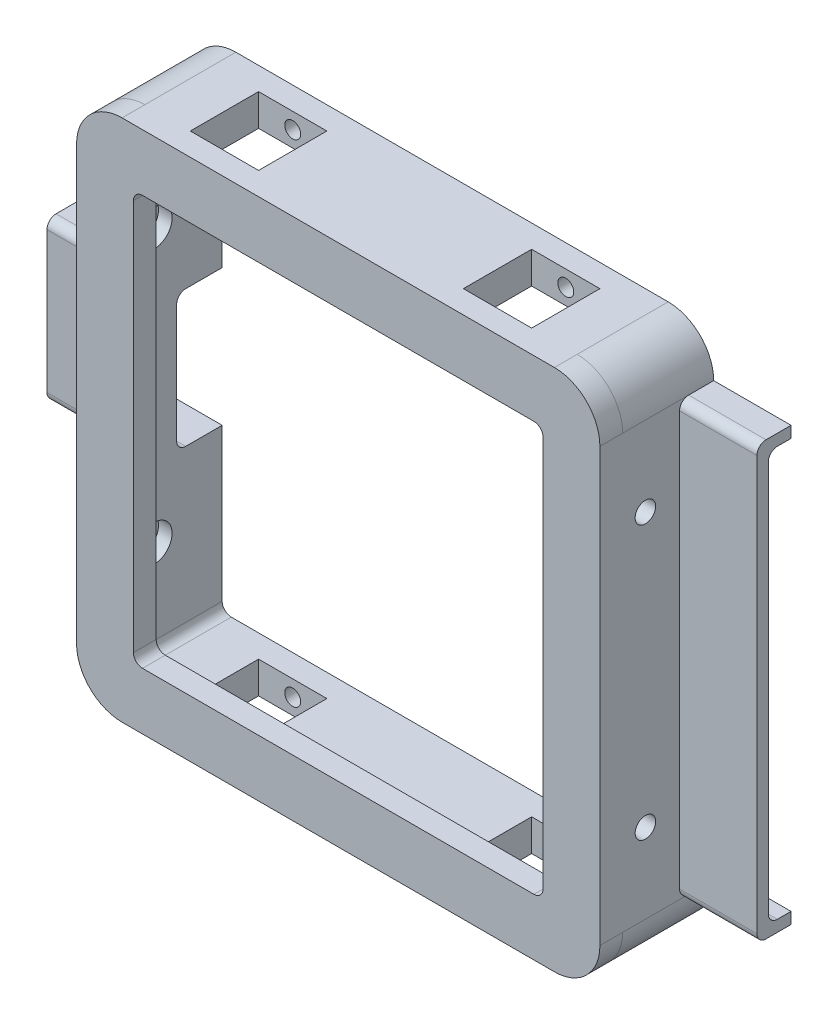
from build123d import *

# Parameters (mm, degrees)
SKETCH1_W                                  = 115
SKETCH1_H                                  = 115
BOSS_EXTRUDE1_DEPTH                        = 20
FILLET1_R                                  = 10
SKETCH2_W                                  = 101
SKETCH2_H                                  = 101
CUT_EXTRUDE1_DEPTH                         = 30
FILLET2_R                                  = 2
SKETCH3_W                                  = 10
SKETCH3_H                                  = 90
CUT_EXTRUDE2_DEPTH                         = 30
SKETCH4_W                                  = 5
SKETCH4_H                                  = 2.5
BOSS_EXTRUDE2_DEPTH                        = 17
FILLET3_R                                  = 2
SKETCH5_W                                  = 20
SKETCH5_H                                  = 30
CUT_EXTRUDE3_DEPTH                         = 22
SKETCH6_W                                  = 10
SKETCH6_H                                  = 2.5
BOSS_EXTRUDE3_DEPTH                        = 19
FILLET4_R                                  = 2
SKETCH7_W                                  = 15
SKETCH7_H                                  = 20
CUT_EXTRUDE4_DEPTH                         = 120
SKETCH9_R                                  = 1.75
CUT_EXTRUDE6_DEPTH                         = 10
MIRROR2_AT_THE_SECOND_PLANE_COPY_1_SKETC_R = 1.75
MIRROR2_AT_THE_SECOND_PLANE_COPY_1_DEPTH   = 10
SKETCH11_R                                 = 2.25
CUT_EXTRUDE7_DEPTH                         = 125
SKETCH12_R                                 = 4
CUT_EXTRUDE8_DEPTH                         = 3
MIRROR4_AT_THE_SECOND_PLANE_COPY_1_SKETC_R = 4
MIRROR4_AT_THE_SECOND_PLANE_COPY_1_DEPTH   = 3
SKETCH14_W                                 = 115
SKETCH14_H                                 = 115
SKETCH14_W_2                               = 90
SKETCH14_H_2                               = 90
BOSS_EXTRUDE4_DEPTH                        = 5
FILLET5_R                                  = 10
FILLET6_R                                  = 2


with BuildPart() as part:
    # Sketch1 → Boss-Extrude1 (new body)
    with BuildSketch(Plane.XY):
        Rectangle(SKETCH1_W, SKETCH1_H)
    extrude(amount=BOSS_EXTRUDE1_DEPTH)

    # Fillet1
    fillet1_edges = [part.edges().sort_by_distance(p)[0] for p in [
        (-57.5, 57.5, 10),
        (57.5, 57.5, 10),
        (57.5, -57.5, 10),
        (-57.5, -57.5, 10),
    ]]
    fillet(fillet1_edges, radius=FILLET1_R)

    # Sketch2 → Cut-Extrude1 (cut)
    with BuildSketch(Plane.XY.offset(20)):
        Rectangle(SKETCH2_W, SKETCH2_H)
    extrude(amount=-CUT_EXTRUDE1_DEPTH, mode=Mode.SUBTRACT)

    # Fillet2
    fillet2_edges = [part.edges().sort_by_distance(p)[0] for p in [
        (-50.5, -50.5, 10),
        (-50.5, 50.5, 10),
        (50.5, 50.5, 10),
        (50.5, -50.5, 10),
    ]]
    fillet(fillet2_edges, radius=FILLET2_R)

    # Sketch3 → Cut-Extrude2 (cut)
    with BuildSketch(Plane(origin=(57.5, 0, 0), x_dir=(0, 0, -1), z_dir=(1, 0, 0))):
        Rectangle(SKETCH3_W, SKETCH3_H)
    extrude(amount=-CUT_EXTRUDE2_DEPTH, mode=Mode.SUBTRACT)

    # Sketch4 → Boss-Extrude2 (add)
    with BuildSketch(Plane(origin=(57.5, 0, 0), x_dir=(0, 0, -1), z_dir=(1, 0, 0))):
        Polygon((-5, -45), (-5, 45), (-5, 47.5), (-7.5, 47.5), (-7.5, -47.5), (-5, -47.5), align=None)
        with Locations((-2.5, 46.25)):
            Rectangle(SKETCH4_W, SKETCH4_H)
        with Locations((-2.5, -46.25)):
            Rectangle(SKETCH4_W, SKETCH4_H)
    extrude(amount=BOSS_EXTRUDE2_DEPTH)

    # Fillet3
    fillet3_edges = [part.edges().sort_by_distance(p)[0] for p in [
        (66, 47.5, 7.5),
        (66, -47.5, 7.5),
        (62.5, -45, 5),
        (62.5, 45, 5),
    ]]
    fillet(fillet3_edges, radius=FILLET3_R)

    # Sketch5 → Cut-Extrude3 (cut)
    with BuildSketch(Plane.ZY.offset(57.5)):
        Rectangle(SKETCH5_W, SKETCH5_H)
    extrude(amount=-CUT_EXTRUDE3_DEPTH, mode=Mode.SUBTRACT)

    # Sketch6 → Boss-Extrude3 (add)
    with BuildSketch(Plane.ZY.offset(57.5)):
        Polygon((10, 17.5), (10, 15), (10, -15), (10, -17.5), (12.5, -17.5), (12.5, 17.5), align=None)
        with Locations((5, 16.25)):
            Rectangle(SKETCH6_W, SKETCH6_H)
        with Locations((5, -16.25)):
            Rectangle(SKETCH6_W, SKETCH6_H)
    extrude(amount=BOSS_EXTRUDE3_DEPTH)

    # Fillet4
    fillet4_edges = [part.edges().sort_by_distance(p)[0] for p in [
        (-63.5, 15, 10),
        (-63.5, -15, 10),
        (-67, -17.5, 12.5),
        (-67, 17.5, 12.5),
    ]]
    fillet(fillet4_edges, radius=FILLET4_R)

    # Sketch7 → Cut-Extrude4 (cut)
    with BuildSketch(Plane(origin=(0, 57.5, 0), x_dir=(1, 0, 0), z_dir=(0, 1, 0))):
        with Locations((-30, -15)):
            Rectangle(SKETCH7_W, SKETCH7_H)
        with Locations((30, -15)):
            Rectangle(SKETCH7_W, SKETCH7_H)
    extrude(amount=-CUT_EXTRUDE4_DEPTH, mode=Mode.SUBTRACT)

    # Sketch9 → Cut-Extrude6 (cut)
    with BuildSketch(Plane(origin=(0, 0, 0), x_dir=(-1, 0, 0), z_dir=(0, 0, -1))):
        with Locations((-30, 54)):
            Circle(SKETCH9_R)
    cut_extrude6 = extrude(amount=-CUT_EXTRUDE6_DEPTH, mode=Mode.SUBTRACT)

    # Mirror2: Cut-Extrude6 across plane
    add(cut_extrude6.mirror(Plane(origin=(0, 0, 0), x_dir=(0, 0, 1), z_dir=(1, 0, 0))), mode=Mode.SUBTRACT)

    # Mirror2 at the second plane: Cut-Extrude6 across plane
    add(cut_extrude6.mirror(Plane.ZX), mode=Mode.SUBTRACT)

    # Mirror2 at the second plane copy 1 sketc → Mirror2 at the second plane copy 1 (cut)
    with BuildSketch(Plane(origin=(0, 0, 0), x_dir=(1, 0, 0), z_dir=(0, 0, -1))):
        with Locations((-30, 54)):
            Circle(MIRROR2_AT_THE_SECOND_PLANE_COPY_1_SKETC_R)
    extrude(amount=-MIRROR2_AT_THE_SECOND_PLANE_COPY_1_DEPTH, mode=Mode.SUBTRACT)

    # Sketch11 → Cut-Extrude7 (cut)
    with BuildSketch(Plane.ZY.offset(57.5)):
        with Locations((15, 30)):
            Circle(SKETCH11_R)
    cut_extrude7 = extrude(amount=-CUT_EXTRUDE7_DEPTH, mode=Mode.SUBTRACT)

    # Mirror3: Cut-Extrude7 across plane
    add(cut_extrude7.mirror(Plane.ZX), mode=Mode.SUBTRACT)

    # Sketch12 → Cut-Extrude8 (cut)
    with BuildSketch(Plane(origin=(-50.5, 0, 0), x_dir=(0, 0, -1), z_dir=(1, 0, 0))):
        with Locations((-15, 30)):
            Circle(SKETCH12_R)
    cut_extrude8 = extrude(amount=-CUT_EXTRUDE8_DEPTH, mode=Mode.SUBTRACT)

    # Mirror4: Cut-Extrude8 across plane
    add(cut_extrude8.mirror(Plane(origin=(0, 0, 0), x_dir=(0, 0, 1), z_dir=(1, 0, 0))), mode=Mode.SUBTRACT)

    # Mirror4 at the second plane: Cut-Extrude8 across plane
    add(cut_extrude8.mirror(Plane.ZX), mode=Mode.SUBTRACT)

    # Mirror4 at the second plane copy 1 sketc → Mirror4 at the second plane copy 1 (cut)
    with BuildSketch(Plane(origin=(50.5, 0, 0), x_dir=(0, 0, -1), z_dir=(-1, 0, 0))):
        with Locations((-15, 30)):
            Circle(MIRROR4_AT_THE_SECOND_PLANE_COPY_1_SKETC_R)
    extrude(amount=-MIRROR4_AT_THE_SECOND_PLANE_COPY_1_DEPTH, mode=Mode.SUBTRACT)

    # Sketch14 → Boss-Extrude4 (add)
    with BuildSketch(Plane.XY.offset(20)):
        Rectangle(SKETCH14_W, SKETCH14_H)
        Rectangle(SKETCH14_W_2, SKETCH14_H_2, mode=Mode.SUBTRACT)
    extrude(amount=BOSS_EXTRUDE4_DEPTH)

    # Fillet5
    fillet5_edges = [part.edges().sort_by_distance(p)[0] for p in [
        (-57.5, -57.5, 22.5),
        (57.5, -57.5, 22.5),
        (-57.5, 57.5, 22.5),
        (57.5, 57.5, 22.5),
    ]]
    fillet(fillet5_edges, radius=FILLET5_R)

    # Fillet6
    fillet6_edges = [part.edges().sort_by_distance(p)[0] for p in [
        (-45, -45, 22.5),
        (45, -45, 22.5),
        (45, 45, 22.5),
        (-45, 45, 22.5),
    ]]
    fillet(fillet6_edges, radius=FILLET6_R)


solid = part.part
